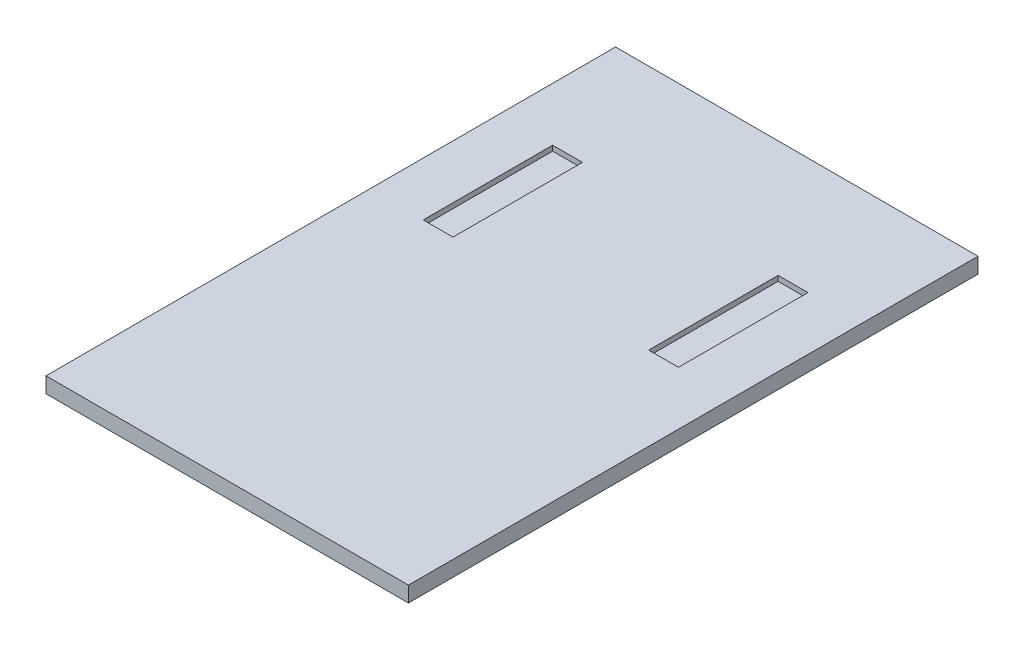
from build123d import *

# Parameters (mm, degrees)
SKETCH1_W           = 1778
SKETCH1_H           = 2794
BOSS_EXTRUDE1_DEPTH = 76.2
SKETCH3_W           = 146.05
SKETCH3_H           = 635
CUT_EXTRUDE1_DEPTH  = 25.4


with BuildPart() as part:
    # Sketch1 → Boss-Extrude1 (new body)
    with BuildSketch(Plane(origin=(0, 0, 0), x_dir=(1, 0, 0), z_dir=(0, 1, 0))):
        Rectangle(SKETCH1_W, SKETCH1_H)
    extrude(amount=BOSS_EXTRUDE1_DEPTH)

    # Sketch3 → Cut-Extrude1 (cut)
    with BuildSketch(Plane(origin=(0, 76.2, 0), x_dir=(1, 0, 0), z_dir=(0, 1, 0))):
        with Locations((553.085, 508)):
            Rectangle(SKETCH3_W, SKETCH3_H)
        with Locations((-553.085, 508)):
            Rectangle(SKETCH3_W, SKETCH3_H)
    extrude(amount=-CUT_EXTRUDE1_DEPTH, mode=Mode.SUBTRACT)


solid = part.part
